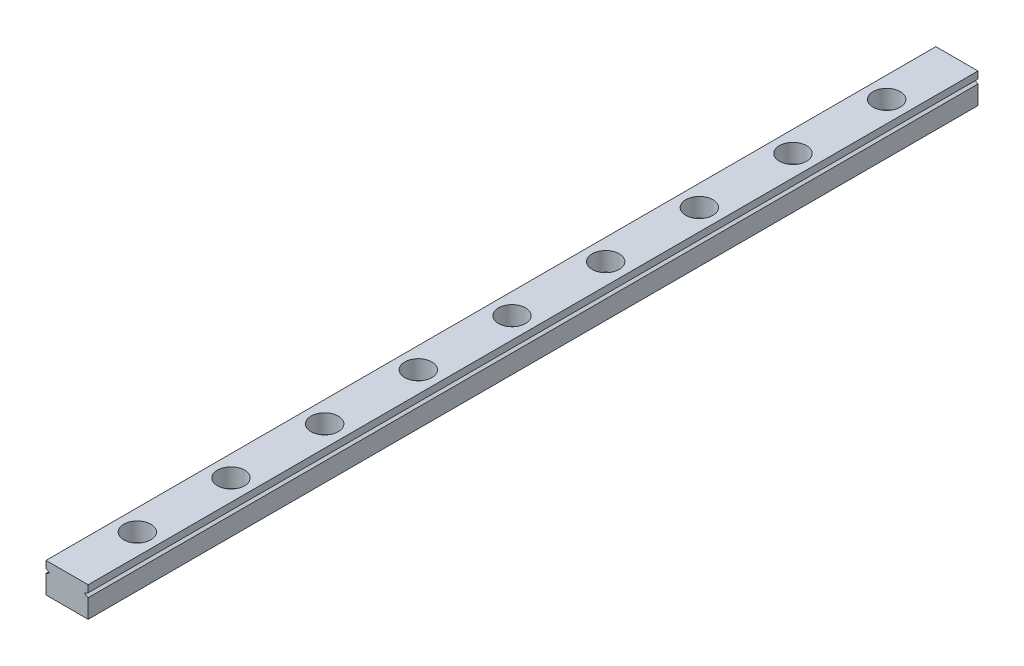
from build123d import *

# Parameters (mm, degrees)
BOSS_EXTRUDE1_DEPTH = 190
SKETCH2_R           = 2.9
CUT_EXTRUDE1_DEPTH  = 4
SKETCH3_R           = 1.7
CUT_EXTRUDE2_DEPTH  = 191.255091916


with BuildPart() as part:
    # Sketch1 → Boss-Extrude1 (new body)
    with BuildSketch(Plane.XY):
        Polygon((9, 6.4), (9, 4.9), (8.2, 4.45), (9, 4), (9, 0), (0, 0), (0, 4), (0.8, 4.45), (0, 4.9), (0, 6.4), align=None)
    extrude(amount=BOSS_EXTRUDE1_DEPTH)

    # Sketch2 → Cut-Extrude1 (cut)
    with BuildSketch(Plane(origin=(0, 6.4, 0), x_dir=(1, 0, 0), z_dir=(0, 1, 0))):
        with Locations(Location((4.5, -175, 0), (0, 0, 270))):
            Circle(SKETCH2_R)
        with Locations(Location((4.5, -155, 0), (0, 0, 270))):
            Circle(SKETCH2_R)
        with Locations(Location((4.5, -135, 0), (0, 0, 270))):
            Circle(SKETCH2_R)
        with Locations(Location((4.5, -115, 0), (0, 0, 270))):
            Circle(SKETCH2_R)
        with Locations(Location((4.5, -95, 0), (0, 0, 270))):
            Circle(SKETCH2_R)
        with Locations(Location((4.5, -75, 0), (0, 0, 270))):
            Circle(SKETCH2_R)
        with Locations(Location((4.5, -55, 0), (0, 0, 270))):
            Circle(SKETCH2_R)
        with Locations(Location((4.5, -35, 0), (0, 0, 270))):
            Circle(SKETCH2_R)
        with Locations(Location((4.5, -15, 0), (0, 0, 270))):
            Circle(SKETCH2_R)
    extrude(amount=-CUT_EXTRUDE1_DEPTH, mode=Mode.SUBTRACT)

    # Sketch3 → Cut-Extrude2 (cut, through all)
    with BuildSketch(Plane(origin=(0, 2.4, 0), x_dir=(1, 0, 0), z_dir=(0, 1, 0))):
        with Locations(Location((4.5, -175, 0), (0, 0, 270))):
            Circle(SKETCH3_R)
        with Locations(Location((4.5, -155, 0), (0, 0, 270))):
            Circle(SKETCH3_R)
        with Locations(Location((4.5, -135, 0), (0, 0, 270))):
            Circle(SKETCH3_R)
        with Locations(Location((4.5, -115, 0), (0, 0, 270))):
            Circle(SKETCH3_R)
        with Locations(Location((4.5, -95, 0), (0, 0, 270))):
            Circle(SKETCH3_R)
        with Locations(Location((4.5, -75, 0), (0, 0, 270))):
            Circle(SKETCH3_R)
        with Locations(Location((4.5, -55, 0), (0, 0, 270))):
            Circle(SKETCH3_R)
        with Locations(Location((4.5, -35, 0), (0, 0, 270))):
            Circle(SKETCH3_R)
        with Locations(Location((4.5, -15, 0), (0, 0, 270))):
            Circle(SKETCH3_R)
    extrude(amount=-CUT_EXTRUDE2_DEPTH, mode=Mode.SUBTRACT)


solid = part.part
